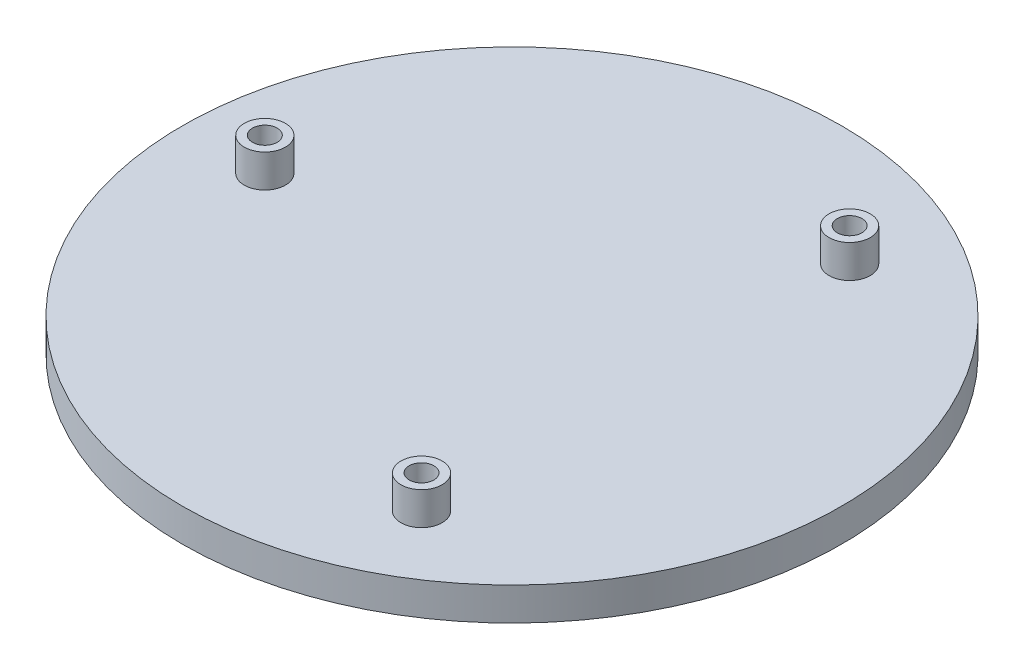
from build123d import *

# Parameters (mm, degrees)
SKETCH3_R           = 3.175
SKETCH3_R_2         = 1.905
BOSS_EXTRUDE1_DEPTH = 5.08


with BuildPart() as part:
    # Sketch1 → Revolve1 (revolve)
    with BuildSketch(Plane.XY, mode=Mode.PRIVATE) as revolve1_sk:
        Polygon((-38.1, -2.54), (0, -2.54), (0, 0), (-50.8, 0), (-50.8, -5.08), (-38.1, -5.08), align=None)
    revolve(revolve1_sk.sketch.rotate(Axis((0, 4.567685351, 0), (0, -1, 0)), 270), axis=Axis((0, 4.567685351, 0), (0, -1, 0)))

    # Sketch3 → Boss-Extrude1 (add)
    # profile 1 of 3: a face of its own
    with BuildSketch(Plane(origin=(0, 0, 0), x_dir=(1, 0, 0), z_dir=(0, 1, 0))):
        with Locations(Location((-38.1, 0, 0), (0, 0, 270))):
            Circle(SKETCH3_R)
        with Locations(Location((-38.1, 0, 0), (0, 0, 270))):
            Circle(SKETCH3_R_2, mode=Mode.SUBTRACT)
    # profile 2 of 3: a face of its own
    with BuildSketch(Plane(origin=(0, 0, 0), x_dir=(1, 0, 0), z_dir=(0, 1, 0))):
        with Locations(Location((19.05, 32.995567884, 0), (0, 0, 270))):
            Circle(SKETCH3_R)
        with Locations(Location((19.05, 32.995567884, 0), (0, 0, 270))):
            Circle(SKETCH3_R_2, mode=Mode.SUBTRACT)
    # profile 3 of 3: a face of its own
    with BuildSketch(Plane(origin=(0, 0, 0), x_dir=(1, 0, 0), z_dir=(0, 1, 0))):
        with Locations(Location((19.05, -32.995567884, 0), (0, 0, 270))):
            Circle(SKETCH3_R)
        with Locations(Location((19.05, -32.995567884, 0), (0, 0, 270))):
            Circle(SKETCH3_R_2, mode=Mode.SUBTRACT)
    extrude(amount=BOSS_EXTRUDE1_DEPTH)


solid = part.part
